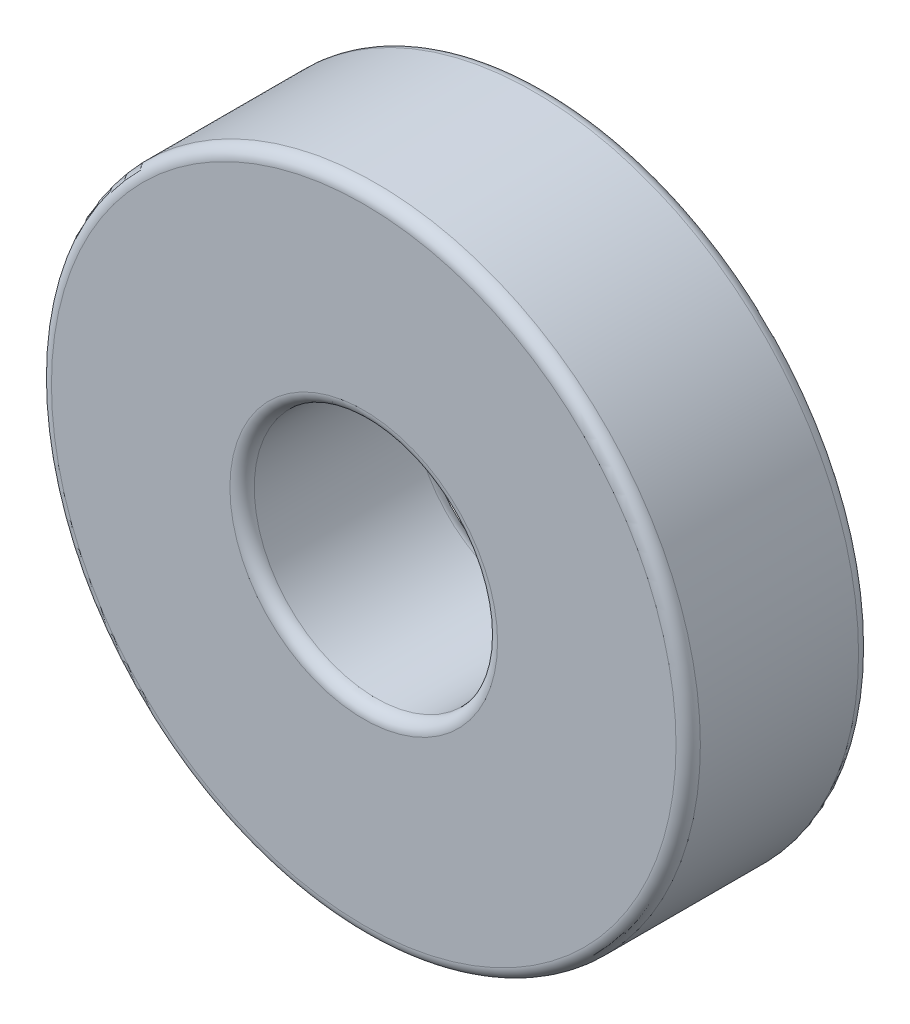
from build123d import *

# Parameters (mm, degrees)
CROQUIS1_R              = 16
CROQUIS1_R_2            = 6
SALIENTE_EXTRUIR1_DEPTH = 9
REDONDEO1_R             = 0.6


with BuildPart() as part:
    # Croquis1 → Saliente-Extruir1 (new body)
    with BuildSketch(Plane.XY):
        Circle(CROQUIS1_R)
        Circle(CROQUIS1_R_2, mode=Mode.SUBTRACT)
    extrude(amount=SALIENTE_EXTRUIR1_DEPTH)

    # Redondeo1
    redondeo1_edges = [part.edges().sort_by_distance(p)[0] for p in [
        (-16, 0, 0),
        (-16, 0, 9),
        (-6, 0, 0),
        (-6, 0, 9),
    ]]
    fillet(redondeo1_edges, radius=REDONDEO1_R)


solid = part.part
